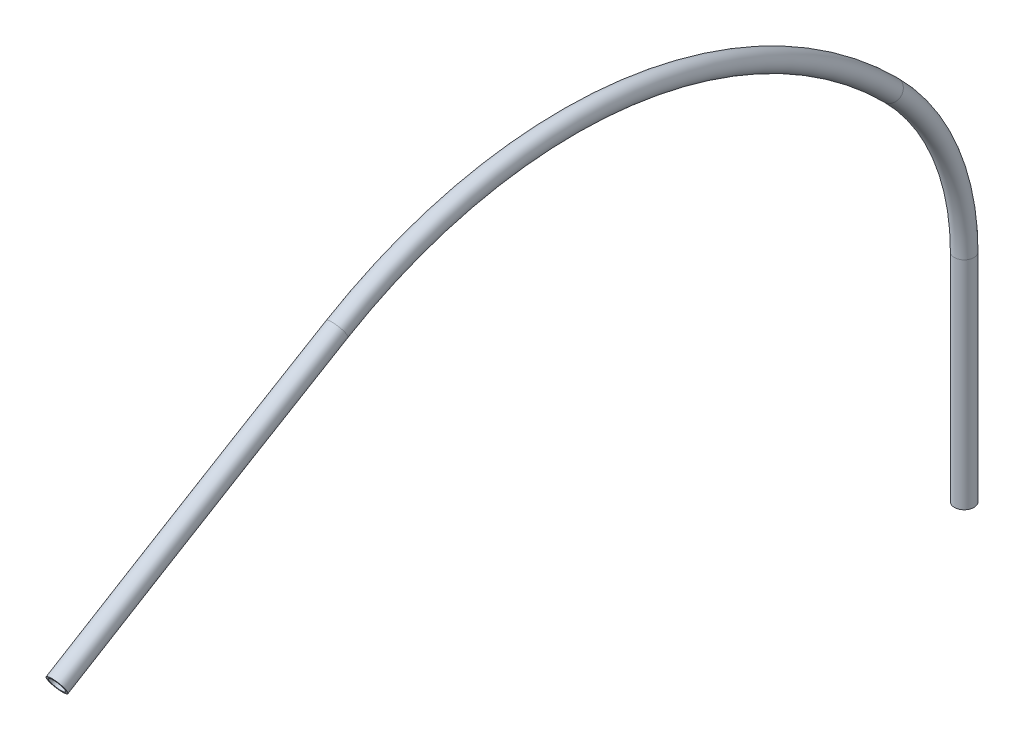
from build123d import *

# Parameters (mm, degrees)
CROQUIS7_R = 5
VACIADO2_T = -1


with BuildPart() as part:
    # Barrer1: sweep along a path in Croquis5
    with BuildLine(Plane(origin=(0, 0, 0), x_dir=(0, 0, -1), z_dir=(1, 0, 0))) as barrer1_path:
        Line((-12, 40), (-12, 150.755404513))
        ThreePointArc((-12, 150.755404513), (-21.681861179, 199.590225681), (-49.262794498, 241.037424762))
        ThreePointArc((-49.262794498, 241.037424762), (-184.905626604, 307.756655581), (-332.920608455, 277.064656453))
        ThreePointArc((-332.920608455, 277.064656453), (-404.710677086, 234.183935346), (-476.226198503, 190.846879685))
    # Croquis7 → Barrer1 (sweep)
    with BuildSketch(Plane(origin=(0, 40, 12), x_dir=(-1, 0, 0), z_dir=(0, 1, 0))):
        Circle(CROQUIS7_R)
    sweep(path=barrer1_path.line)

    # Vaciado2
    vaciado2_openings = [part.faces().sort_by_distance(p)[0] for p in [
        (0, 190.846879685, 476.226198503),
        (0, 40, 12),
    ]]
    offset(amount=VACIADO2_T, openings=vaciado2_openings, kind=Kind.INTERSECTION)


solid = part.part
